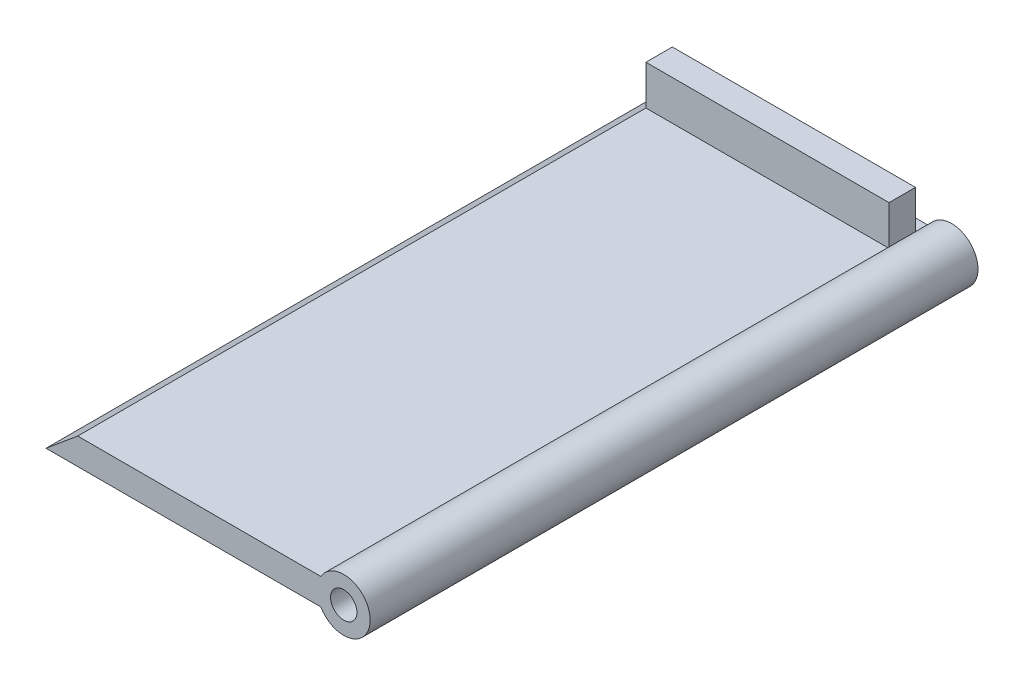
from build123d import *

# Parameters (mm, degrees)
SKETCH1_R           = 3.175
BOSS_EXTRUDE1_DEPTH = 146.05
BOSS_EXTRUDE2_DEPTH = 3.175
SKETCH3_W           = 58.42
SKETCH3_H           = 9.525
BOSS_EXTRUDE3_DEPTH = 3.175
BOSS_EXTRUDE4_DEPTH = 146.05
CUT_EXTRUDE1_DEPTH  = 146.05


with BuildPart() as part:
    # Sketch1 → Boss-Extrude1 (new body)
    with BuildSketch(Plane.XY):
        with BuildLine():
            Line((-33.243254954, 2.815203929), (-25.623254954, -3.534796071))
            Line((-25.623254954, -3.534796071), (32.796745046, -3.534796071))
            ThreePointArc((32.796745046, -3.534796071), (44.64600636, -0.359796071), (32.796745046, 2.815203929))
            Line((32.796745046, 2.815203929), (-33.243254954, 2.815203929))
        make_face()
        with Locations((38.29600636, -0.359796071)):
            Circle(SKETCH1_R, mode=Mode.SUBTRACT)
    extrude(amount=BOSS_EXTRUDE1_DEPTH)

    # Sketch2 → Boss-Extrude2 (add)
    with BuildSketch(Plane.XY.offset(3.175)):
        Polygon((-22.448254954, 2.815203929), (-25.623254954, 2.815203929), (-25.623254954, 12.340203929), (32.796745046, 12.340203929), (32.796745046, 2.815203929), (29.621745046, 2.815203929), (29.621745046, 9.165203929), (-22.448254954, 9.165203929), align=None)
    extrude(amount=BOSS_EXTRUDE2_DEPTH)

    # Sketch3 → Boss-Extrude3 (add)
    with BuildSketch(Plane.XY.offset(6.35)):
        with Locations((3.586745046, 7.577703929)):
            Rectangle(SKETCH3_W, SKETCH3_H)
    extrude(amount=BOSS_EXTRUDE3_DEPTH)

    # Sketch4 → Boss-Extrude4 (add)
    with BuildSketch(Plane.XY.offset(146.05)):
        Polygon((-33.243254954, 2.815203929), (-33.243254954, -3.534796071), (-25.623254954, -3.534796071), align=None)
    extrude(amount=-BOSS_EXTRUDE4_DEPTH)

    # Sketch5 → Cut-Extrude1 (cut)
    with BuildSketch(Plane.XY.offset(146.05)):
        Polygon((-33.243254954, -3.534796071), (-25.623254954, 2.815203929), (-33.243254954, 2.815203929), align=None)
    extrude(amount=-CUT_EXTRUDE1_DEPTH, mode=Mode.SUBTRACT)


solid = part.part
